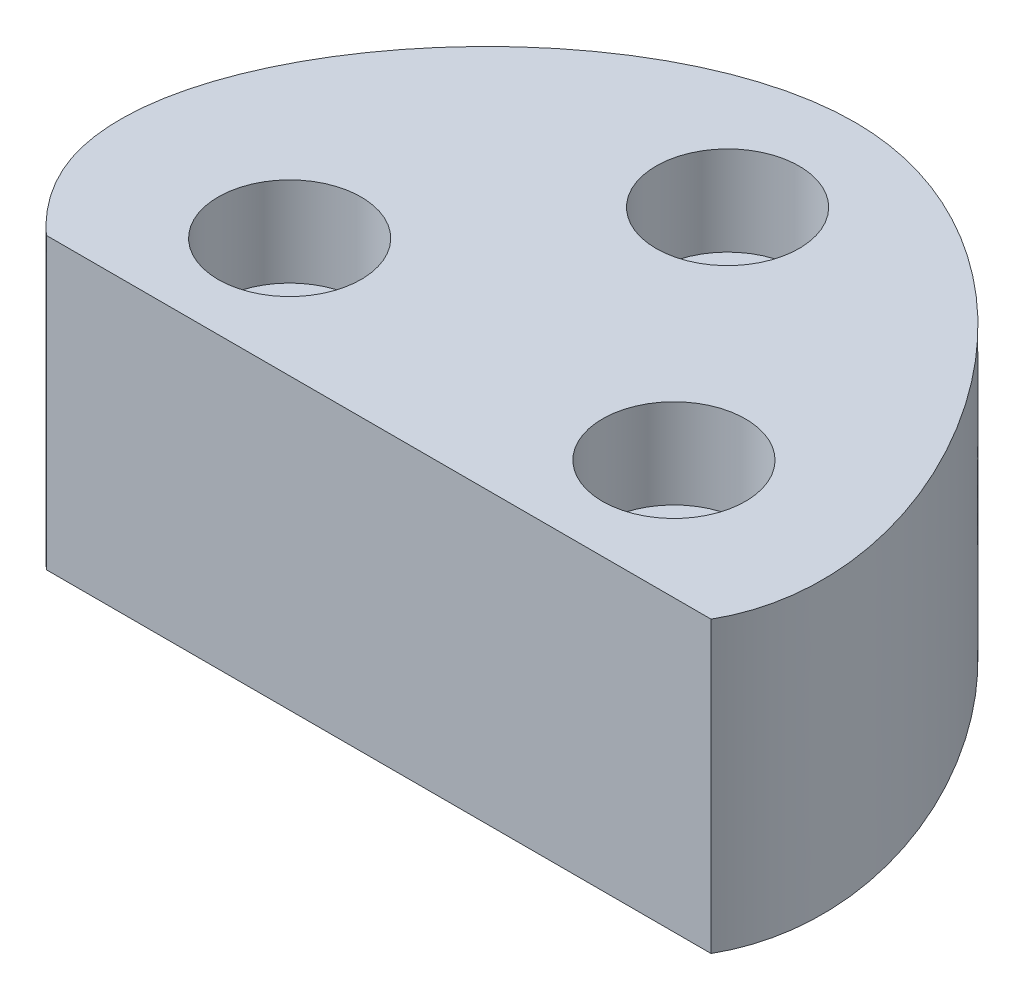
from build123d import *

# Parameters (mm, degrees)
SKETCH2_R           = 50
BOSS_EXTRUDE1_DEPTH = 16.2
SKETCH7_R           = 4
CUT_EXTRUDE2_DEPTH  = 5
SKETCH4_R           = 4
CUT_EXTRUDE3_DEPTH  = 5
CUT_EXTRUDE6_START  = -20
SKETCH10_R          = 50
CUT_EXTRUDE6_DEPTH  = 20
SKETCH10_5_W        = 37.880831295
SKETCH10_5_H        = 13.400021955
CUT_EXTRUDE7_DEPTH  = 20


with BuildPart() as part:
    # Sketch2 → Boss-Extrude1 (new body)
    with BuildSketch(Plane(origin=(0, 0, 0), x_dir=(1, 0, 0), z_dir=(0, 1, 0))):
        with Locations(Location((0, 0, 0), (0, 0, 270))):
            Circle(SKETCH2_R)
    extrude(amount=BOSS_EXTRUDE1_DEPTH)

    # Sketch7 → Cut-Extrude2 (cut)
    with BuildSketch(Plane(origin=(0, 16.2, 0), x_dir=(1, 0, 0), z_dir=(0, 1, 0))):
        with Locations(Location((-10.75, -13.75, 0), (0, 0, 270))):
            Circle(SKETCH7_R)
    cut_extrude2 = extrude(amount=-CUT_EXTRUDE2_DEPTH, mode=Mode.SUBTRACT)

    # Mirror1: Cut-Extrude2 across plane
    add(cut_extrude2.mirror(Plane(origin=(0, 0, 0), x_dir=(0, 0, 1), z_dir=(1, 0, 0))), mode=Mode.SUBTRACT)

    # Sketch4 → Cut-Extrude3 (cut)
    with BuildSketch(Plane(origin=(0, 16.2, 0), x_dir=(1, 0, 0), z_dir=(0, 1, 0))):
        with Locations(Location((0, 0, 0), (0, 0, 270))):
            Circle(SKETCH4_R)
    extrude(amount=-CUT_EXTRUDE3_DEPTH, mode=Mode.SUBTRACT)

    # Sketch10 → Cut-Extrude6 (cut)
    with BuildSketch(Plane(origin=(0, 16.2, 0), x_dir=(1, 0, 0), z_dir=(0, 1, 0)).offset(CUT_EXTRUDE6_START)):
        Circle(SKETCH10_R)
        with BuildLine():
            Line((-18.389453031, -33.817018788), (-18.389453031, -20.416996833))
            Line((-18.389453031, -20.416996833), (-17.695652793, -20.416996833))
            add(Edge.make_bspline(
                [(0, 7.671510726), (-11.676219754, 8.158908111), (-26.132266975, -9.274364796), (-19.091439708, -19.131313204), (-17.695652793, -20.416996833)],
                knots=[0, 0, 0, 0, 0.296673026, 0.348421636, 0.348421636, 0.348421636, 0.348421636], degree=3))
            add(Edge.make_bspline(
                [(19.491378264, -20.416996833), (24.616575565, -11.472242374), (12.681498722, 7.142150245), (0, 7.671510726)],
                knots=[0.677784533, 0.677784533, 0.677784533, 0.677784533, 1, 1, 1, 1], degree=3))
            Line((19.491378264, -20.416996833), (19.491378264, -33.817018788))
            Line((19.491378264, -33.817018788), (-18.389453031, -33.817018788))
        make_face(mode=Mode.SUBTRACT)
    extrude(amount=CUT_EXTRUDE6_DEPTH, mode=Mode.SUBTRACT)

    # Sketch10<5> → Cut-Extrude7 (cut)
    with BuildSketch(Plane(origin=(0, 16.2, 0), x_dir=(1, 0, 0), z_dir=(0, 1, 0))):
        with BuildLine():
            Line((19.491378264, -20.416996833), (-17.695652793, -20.416996833))
            add(Edge.make_bspline(
                [(-17.695652793, -20.416996833), (-8.811927665, -28.599950719), (14.252493091, -29.560165139), (19.491378264, -20.416996833)],
                knots=[0.348421636, 0.348421636, 0.348421636, 0.348421636, 0.677784533, 0.677784533, 0.677784533, 0.677784533], degree=3))
        make_face()
        with Locations((0.550962616, -27.11700781)):
            Rectangle(SKETCH10_5_W, SKETCH10_5_H)
    extrude(amount=-CUT_EXTRUDE7_DEPTH, mode=Mode.SUBTRACT)


solid = part.part
